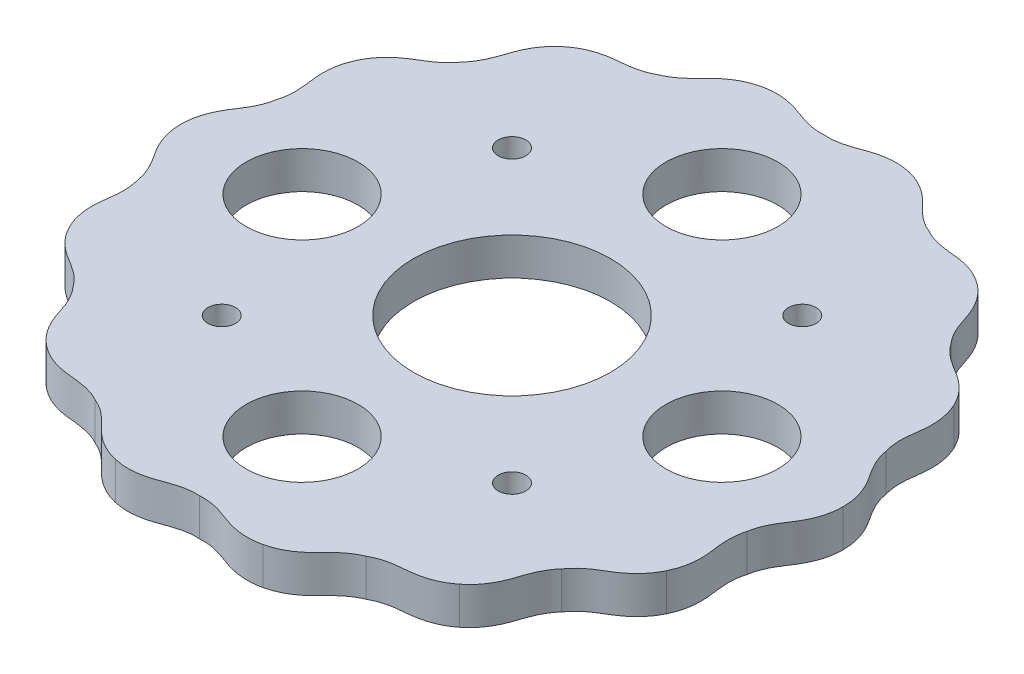
from build123d import *

# Parameters (mm, degrees)
BOSS_EXTRUDE3_DEPTH = 4
SKETCH2_R           = 10.5635
SKETCH2_R_2         = 6
CUT_EXTRUDE1_DEPTH  = 5
SKETCH2_4_R         = 1.48
CUT_EXTRUDE2_DEPTH  = 2.22


with BuildPart() as part:
    # Sketch1 → Boss-Extrude3 (new body)
    with BuildSketch(Plane(origin=(0, 0, 0), x_dir=(1, 0, 0), z_dir=(0, 1, 0))):
        with BuildLine():
            Line((35.500002326, 0.003735881), (35.500002326, 0))
            Line((35.500002326, 0), (35.500002326, -0.003735881))
            add(Edge.make_bspline(
                [(32.644810899, -7.45096506), (32.674793712, -7.260710929), (32.757965618, -6.873262555), (32.975088878, -6.197475635), (33.30681421, -5.487322542), (33.693887271, -4.83935734), (34.139372051, -4.165162167), (34.499748971, -3.6014921), (34.870711868, -2.889611748), (35.149566879, -2.192738575), (35.418263863, -1.23361479), (35.50061524, -0.495919336), (35.500002326, -0.003735881)],
                knots=[0.02301065, 0.02301065, 0.02301065, 0.02301065, 0.053541567, 0.084072485, 0.145134319, 0.206196153, 0.267257988, 0.389381656, 0.511505325, 0.633628994, 0.755752663, 1, 1, 1, 1], degree=3))
            add(Edge.make_bspline(
                [(31.986017844, -15.399507835), (32.200120458, -14.956331799), (32.445998494, -14.255960238), (32.62005909, -13.275236314), (32.671181344, -12.526384626), (32.645828632, -11.724047822), (32.565707523, -11.059836954), (32.456861927, -10.25911949), (32.389262714, -9.507378309), (32.398512397, -8.723622254), (32.496104055, -8.020553026), (32.589276306, -7.635387164), (32.644810899, -7.45096506)],
                knots=[0.02301065, 0.02301065, 0.02301065, 0.02301065, 0.267257988, 0.389381656, 0.511505325, 0.633628994, 0.755752663, 0.816814497, 0.877876331, 0.938938166, 0.969469083, 1, 1, 1, 1], degree=3))
            Line((31.986017844, -15.399507835), (31.984396906, -15.402873748))
            Line((31.984396906, -15.402873748), (31.982775968, -15.406239661))
            add(Edge.make_bspline(
                [(26.179105738, -20.877140171), (26.288667493, -20.718736177), (26.531710341, -20.405744191), (27.020544594, -19.891087467), (27.62754267, -19.395191866), (28.257425012, -18.979340099), (28.951315253, -18.565199839), (29.520570914, -18.213712342), (30.163670245, -17.733285076), (30.717271866, -17.226414698), (31.375507699, -16.478857279), (31.769777787, -15.849947564), (31.982775968, -15.406239661)],
                knots=[0.02301065, 0.02301065, 0.02301065, 0.02301065, 0.053541567, 0.084072485, 0.145134319, 0.206196153, 0.267257988, 0.389381656, 0.511505325, 0.633628994, 0.755752663, 1, 1, 1, 1], degree=3))
            add(Edge.make_bspline(
                [(22.136810246, -27.752690162), (22.521996911, -27.446297993), (23.047405198, -26.921967502), (23.62974854, -26.113887841), (24.00072267, -25.461376898), (24.326001557, -24.727496287), (24.542005228, -24.094299727), (24.791357022, -23.325651886), (25.05662051, -22.619026286), (25.405013194, -21.916899767), (25.797990545, -21.325799714), (26.049053047, -21.019203188), (26.179105738, -20.877140171)],
                knots=[0.02301065, 0.02301065, 0.02301065, 0.02301065, 0.267257988, 0.389381656, 0.511505325, 0.633628994, 0.755752663, 0.816814497, 0.877876331, 0.938938166, 0.969469083, 1, 1, 1, 1], degree=3))
            Line((22.136810246, -27.752690162), (22.133889416, -27.755019446))
            Line((22.133889416, -27.755019446), (22.130968587, -27.75734873))
            add(Edge.make_bspline(
                [(14.52830762, -30.168341629), (14.695748267, -30.073161626), (15.05052444, -29.89661793), (15.714250068, -29.645025478), (16.476297475, -29.461605575), (17.224233175, -29.360231784), (18.029095404, -29.288171996), (18.694481743, -29.218483478), (19.482343797, -29.064663811), (20.201044438, -28.848188121), (21.118447439, -28.460259983), (21.746546212, -28.06469929), (22.130968587, -27.75734873)],
                knots=[0.02301065, 0.02301065, 0.02301065, 0.02301065, 0.053541567, 0.084072485, 0.145134319, 0.206196153, 0.267257988, 0.389381656, 0.511505325, 0.633628994, 0.755752663, 1, 1, 1, 1], degree=3))
            add(Edge.make_bspline(
                [(7.903135888, -34.609111839), (8.383115662, -34.500188263), (9.083990645, -34.255748926), (9.959276491, -33.780363616), (10.576626521, -33.353431213), (11.188111536, -32.833360849), (11.657457809, -32.356590942), (12.215619812, -31.772252855), (12.761207314, -31.250698702), (13.379739556, -30.769266488), (13.990268616, -30.407210225), (14.349495361, -30.239908237), (14.52830762, -30.168341629)],
                knots=[0.02301065, 0.02301065, 0.02301065, 0.02301065, 0.267257988, 0.389381656, 0.511505325, 0.633628994, 0.755752663, 0.816814497, 0.877876331, 0.938938166, 0.969469083, 1, 1, 1, 1], degree=3))
            Line((7.903135888, -34.609111839), (7.899493673, -34.60994315))
            Line((7.899493673, -34.60994315), (7.895851458, -34.610774462))
            add(Edge.make_bspline(
                [(0, -33.484333037), (0.192155866, -33.471228592), (0.588397592, -33.466099831), (1.295555593, -33.527402621), (2.061719496, -33.692786976), (2.779570716, -33.925969485), (3.535992098, -34.210262493), (4.165721189, -34.43617562), (4.942300224, -34.639429423), (5.683752409, -34.756224087), (6.678619663, -34.804759157), (7.416144457, -34.72089313), (7.895851458, -34.610774462)],
                knots=[0.02301065, 0.02301065, 0.02301065, 0.02301065, 0.053541567, 0.084072485, 0.145134319, 0.206196153, 0.267257988, 0.389381656, 0.511505325, 0.633628994, 0.755752663, 1, 1, 1, 1], degree=3))
            add(Edge.make_bspline(
                [(-7.895851458, -34.610774462), (-7.416144457, -34.72089313), (-6.678619663, -34.804759157), (-5.683752409, -34.756224087), (-4.942300224, -34.639429423), (-4.165721189, -34.43617562), (-3.535992098, -34.210262493), (-2.779570716, -33.925969485), (-2.061719496, -33.692786976), (-1.295555593, -33.527402621), (-0.588397592, -33.466099831), (-0.192155866, -33.471228592), (0, -33.484333037)],
                knots=[0.02301065, 0.02301065, 0.02301065, 0.02301065, 0.267257988, 0.389381656, 0.511505325, 0.633628994, 0.755752663, 0.816814497, 0.877876331, 0.938938166, 0.969469083, 1, 1, 1, 1], degree=3))
            Line((-7.895851458, -34.610774462), (-7.899493673, -34.60994315))
            Line((-7.899493673, -34.60994315), (-7.903135888, -34.609111839))
            add(Edge.make_bspline(
                [(-14.52830762, -30.168341629), (-14.349495361, -30.239908237), (-13.990268616, -30.407210225), (-13.379739556, -30.769266488), (-12.761207314, -31.250698702), (-12.215619812, -31.772252855), (-11.657457809, -32.356590942), (-11.188111536, -32.833360849), (-10.576626521, -33.353431213), (-9.959276491, -33.780363616), (-9.083990645, -34.255748926), (-8.383115662, -34.500188263), (-7.903135888, -34.609111839)],
                knots=[0.02301065, 0.02301065, 0.02301065, 0.02301065, 0.053541567, 0.084072485, 0.145134319, 0.206196153, 0.267257988, 0.389381656, 0.511505325, 0.633628994, 0.755752663, 1, 1, 1, 1], degree=3))
            add(Edge.make_bspline(
                [(-22.130968587, -27.75734873), (-21.746546212, -28.06469929), (-21.118447439, -28.460259983), (-20.201044438, -28.848188121), (-19.482343797, -29.064663811), (-18.694481743, -29.218483478), (-18.029095404, -29.288171996), (-17.224233175, -29.360231784), (-16.476297475, -29.461605575), (-15.714250068, -29.645025478), (-15.05052444, -29.89661793), (-14.695748267, -30.073161626), (-14.52830762, -30.168341629)],
                knots=[0.02301065, 0.02301065, 0.02301065, 0.02301065, 0.267257988, 0.389381656, 0.511505325, 0.633628994, 0.755752663, 0.816814497, 0.877876331, 0.938938166, 0.969469083, 1, 1, 1, 1], degree=3))
            Line((-22.130968587, -27.75734873), (-22.133889416, -27.755019446))
            Line((-22.133889416, -27.755019446), (-22.136810246, -27.752690162))
            add(Edge.make_bspline(
                [(-26.179105738, -20.877140171), (-26.049053047, -21.019203188), (-25.797990545, -21.325799714), (-25.405013194, -21.916899767), (-25.05662051, -22.619026286), (-24.791357022, -23.325651886), (-24.542005228, -24.094299727), (-24.326001557, -24.727496287), (-24.00072267, -25.461376898), (-23.62974854, -26.113887841), (-23.047405198, -26.921967502), (-22.521996911, -27.446297993), (-22.136810246, -27.752690162)],
                knots=[0.02301065, 0.02301065, 0.02301065, 0.02301065, 0.053541567, 0.084072485, 0.145134319, 0.206196153, 0.267257988, 0.389381656, 0.511505325, 0.633628994, 0.755752663, 1, 1, 1, 1], degree=3))
            add(Edge.make_bspline(
                [(-31.982775968, -15.406239661), (-31.769777787, -15.849947564), (-31.375507698, -16.478857279), (-30.717271866, -17.226414698), (-30.163670245, -17.733285076), (-29.520570914, -18.213712342), (-28.951315253, -18.565199839), (-28.257425012, -18.979340099), (-27.62754267, -19.395191866), (-27.020544594, -19.891087467), (-26.531710341, -20.405744191), (-26.288667493, -20.718736177), (-26.179105738, -20.877140171)],
                knots=[0.02301065, 0.02301065, 0.02301065, 0.02301065, 0.267257988, 0.389381656, 0.511505325, 0.633628994, 0.755752663, 0.816814497, 0.877876331, 0.938938166, 0.969469083, 1, 1, 1, 1], degree=3))
            Line((-31.982775968, -15.406239661), (-31.984396906, -15.402873748))
            Line((-31.984396906, -15.402873748), (-31.986017844, -15.399507835))
            add(Edge.make_bspline(
                [(-32.644810899, -7.45096506), (-32.589276306, -7.635387164), (-32.496104055, -8.020553026), (-32.398512397, -8.723622254), (-32.389262714, -9.507378309), (-32.456861927, -10.25911949), (-32.565707523, -11.059836954), (-32.645828632, -11.724047822), (-32.671181344, -12.526384626), (-32.62005909, -13.275236314), (-32.445998494, -14.255960238), (-32.200120458, -14.956331799), (-31.986017844, -15.399507835)],
                knots=[0.02301065, 0.02301065, 0.02301065, 0.02301065, 0.053541567, 0.084072485, 0.145134319, 0.206196153, 0.267257988, 0.389381656, 0.511505325, 0.633628994, 0.755752663, 1, 1, 1, 1], degree=3))
            add(Edge.make_bspline(
                [(-35.500002326, -0.003735881), (-35.50061524, -0.495919336), (-35.418263863, -1.23361479), (-35.149566879, -2.192738575), (-34.870711868, -2.889611748), (-34.499748971, -3.6014921), (-34.139372051, -4.165162167), (-33.693887271, -4.83935734), (-33.30681421, -5.487322542), (-32.975088878, -6.197475635), (-32.757965618, -6.873262555), (-32.674793712, -7.260710929), (-32.644810899, -7.45096506)],
                knots=[0.02301065, 0.02301065, 0.02301065, 0.02301065, 0.267257988, 0.389381656, 0.511505325, 0.633628994, 0.755752663, 0.816814497, 0.877876331, 0.938938166, 0.969469083, 1, 1, 1, 1], degree=3))
            Line((-35.500002326, -0.003735881), (-35.500002326, 0))
            Line((-35.500002326, 0), (-35.500002326, 0.003735881))
            add(Edge.make_bspline(
                [(-32.644810899, 7.45096506), (-32.674793712, 7.260710929), (-32.757965618, 6.873262555), (-32.975088878, 6.197475635), (-33.30681421, 5.487322542), (-33.693887271, 4.83935734), (-34.139372051, 4.165162167), (-34.499748971, 3.6014921), (-34.870711868, 2.889611748), (-35.149566879, 2.192738575), (-35.418263863, 1.23361479), (-35.50061524, 0.495919336), (-35.500002326, 0.003735881)],
                knots=[0.02301065, 0.02301065, 0.02301065, 0.02301065, 0.053541567, 0.084072485, 0.145134319, 0.206196153, 0.267257988, 0.389381656, 0.511505325, 0.633628994, 0.755752663, 1, 1, 1, 1], degree=3))
            add(Edge.make_bspline(
                [(-31.986017844, 15.399507835), (-32.200120458, 14.956331799), (-32.445998494, 14.255960238), (-32.62005909, 13.275236314), (-32.671181344, 12.526384626), (-32.645828632, 11.724047822), (-32.565707523, 11.059836954), (-32.456861927, 10.25911949), (-32.389262714, 9.507378309), (-32.398512397, 8.723622254), (-32.496104055, 8.020553026), (-32.589276306, 7.635387164), (-32.644810899, 7.45096506)],
                knots=[0.02301065, 0.02301065, 0.02301065, 0.02301065, 0.267257988, 0.389381656, 0.511505325, 0.633628994, 0.755752663, 0.816814497, 0.877876331, 0.938938166, 0.969469083, 1, 1, 1, 1], degree=3))
            Line((-31.986017844, 15.399507835), (-31.984396906, 15.402873748))
            Line((-31.984396906, 15.402873748), (-31.982775968, 15.406239661))
            add(Edge.make_bspline(
                [(-26.179105738, 20.877140171), (-26.288667493, 20.718736177), (-26.531710341, 20.405744191), (-27.020544594, 19.891087467), (-27.62754267, 19.395191866), (-28.257425012, 18.979340099), (-28.951315253, 18.565199839), (-29.520570914, 18.213712342), (-30.163670245, 17.733285076), (-30.717271866, 17.226414698), (-31.375507699, 16.478857278), (-31.769777787, 15.849947564), (-31.982775968, 15.406239661)],
                knots=[0.02301065, 0.02301065, 0.02301065, 0.02301065, 0.053541567, 0.084072485, 0.145134319, 0.206196153, 0.267257988, 0.389381656, 0.511505325, 0.633628994, 0.755752663, 1, 1, 1, 1], degree=3))
            add(Edge.make_bspline(
                [(-22.136810246, 27.752690162), (-22.521996911, 27.446297993), (-23.047405198, 26.921967502), (-23.62974854, 26.113887841), (-24.00072267, 25.461376898), (-24.326001557, 24.727496287), (-24.542005228, 24.094299727), (-24.791357022, 23.325651886), (-25.05662051, 22.619026286), (-25.405013194, 21.916899767), (-25.797990545, 21.325799714), (-26.049053047, 21.019203188), (-26.179105738, 20.877140171)],
                knots=[0.02301065, 0.02301065, 0.02301065, 0.02301065, 0.267257988, 0.389381656, 0.511505325, 0.633628994, 0.755752663, 0.816814497, 0.877876331, 0.938938166, 0.969469083, 1, 1, 1, 1], degree=3))
            Line((-22.136810246, 27.752690162), (-22.133889416, 27.755019446))
            Line((-22.133889416, 27.755019446), (-22.130968587, 27.75734873))
            add(Edge.make_bspline(
                [(-14.52830762, 30.168341629), (-14.695748267, 30.073161626), (-15.05052444, 29.89661793), (-15.714250068, 29.645025478), (-16.476297475, 29.461605575), (-17.224233175, 29.360231784), (-18.029095404, 29.288171996), (-18.694481743, 29.218483478), (-19.482343797, 29.064663811), (-20.201044438, 28.848188121), (-21.118447439, 28.460259983), (-21.746546212, 28.06469929), (-22.130968587, 27.75734873)],
                knots=[0.02301065, 0.02301065, 0.02301065, 0.02301065, 0.053541567, 0.084072485, 0.145134319, 0.206196153, 0.267257988, 0.389381656, 0.511505325, 0.633628994, 0.755752663, 1, 1, 1, 1], degree=3))
            add(Edge.make_bspline(
                [(-7.903135888, 34.609111839), (-8.383115662, 34.500188263), (-9.083990645, 34.255748926), (-9.959276491, 33.780363616), (-10.576626521, 33.353431213), (-11.188111536, 32.833360849), (-11.657457809, 32.356590942), (-12.215619812, 31.772252855), (-12.761207314, 31.250698702), (-13.379739556, 30.769266488), (-13.990268616, 30.407210225), (-14.349495361, 30.239908237), (-14.52830762, 30.168341629)],
                knots=[0.02301065, 0.02301065, 0.02301065, 0.02301065, 0.267257988, 0.389381656, 0.511505325, 0.633628994, 0.755752663, 0.816814497, 0.877876331, 0.938938166, 0.969469083, 1, 1, 1, 1], degree=3))
            Line((-7.903135888, 34.609111839), (-7.899493673, 34.60994315))
            Line((-7.899493673, 34.60994315), (-7.895851458, 34.610774462))
            add(Edge.make_bspline(
                [(0, 33.484333037), (-0.192155866, 33.471228592), (-0.588397592, 33.466099831), (-1.295555593, 33.527402621), (-2.061719496, 33.692786976), (-2.779570716, 33.925969485), (-3.535992098, 34.210262493), (-4.165721189, 34.43617562), (-4.942300224, 34.639429423), (-5.683752409, 34.756224087), (-6.678619663, 34.804759157), (-7.416144457, 34.72089313), (-7.895851458, 34.610774462)],
                knots=[0.02301065, 0.02301065, 0.02301065, 0.02301065, 0.053541567, 0.084072485, 0.145134319, 0.206196153, 0.267257988, 0.389381656, 0.511505325, 0.633628994, 0.755752663, 1, 1, 1, 1], degree=3))
            add(Edge.make_bspline(
                [(7.895851458, 34.610774462), (7.416144457, 34.72089313), (6.678619663, 34.804759157), (5.683752409, 34.756224087), (4.942300224, 34.639429423), (4.165721189, 34.43617562), (3.535992098, 34.210262493), (2.779570716, 33.925969485), (2.061719496, 33.692786976), (1.295555593, 33.527402621), (0.588397592, 33.466099831), (0.192155866, 33.471228592), (0, 33.484333037)],
                knots=[0.02301065, 0.02301065, 0.02301065, 0.02301065, 0.267257988, 0.389381656, 0.511505325, 0.633628994, 0.755752663, 0.816814497, 0.877876331, 0.938938166, 0.969469083, 1, 1, 1, 1], degree=3))
            Line((7.895851458, 34.610774462), (7.899493673, 34.60994315))
            Line((7.899493673, 34.60994315), (7.903135888, 34.609111839))
            add(Edge.make_bspline(
                [(14.52830762, 30.168341629), (14.349495361, 30.239908237), (13.990268616, 30.407210225), (13.379739556, 30.769266488), (12.761207314, 31.250698702), (12.215619812, 31.772252855), (11.657457809, 32.356590942), (11.188111536, 32.833360849), (10.576626521, 33.353431213), (9.959276491, 33.780363616), (9.083990645, 34.255748926), (8.383115662, 34.500188263), (7.903135888, 34.609111839)],
                knots=[0.02301065, 0.02301065, 0.02301065, 0.02301065, 0.053541567, 0.084072485, 0.145134319, 0.206196153, 0.267257988, 0.389381656, 0.511505325, 0.633628994, 0.755752663, 1, 1, 1, 1], degree=3))
            add(Edge.make_bspline(
                [(22.130968587, 27.75734873), (21.746546212, 28.06469929), (21.118447439, 28.460259983), (20.201044438, 28.848188121), (19.482343797, 29.064663811), (18.694481743, 29.218483478), (18.029095404, 29.288171996), (17.224233175, 29.360231784), (16.476297475, 29.461605575), (15.714250068, 29.645025478), (15.05052444, 29.89661793), (14.695748267, 30.073161626), (14.52830762, 30.168341629)],
                knots=[0.02301065, 0.02301065, 0.02301065, 0.02301065, 0.267257988, 0.389381656, 0.511505325, 0.633628994, 0.755752663, 0.816814497, 0.877876331, 0.938938166, 0.969469083, 1, 1, 1, 1], degree=3))
            Line((22.130968587, 27.75734873), (22.133889416, 27.755019446))
            Line((22.133889416, 27.755019446), (22.136810246, 27.752690162))
            add(Edge.make_bspline(
                [(26.179105738, 20.877140171), (26.049053047, 21.019203188), (25.797990545, 21.325799714), (25.405013194, 21.916899767), (25.05662051, 22.619026286), (24.791357022, 23.325651886), (24.542005228, 24.094299727), (24.326001557, 24.727496287), (24.00072267, 25.461376898), (23.62974854, 26.113887841), (23.047405198, 26.921967502), (22.521996911, 27.446297993), (22.136810246, 27.752690162)],
                knots=[0.02301065, 0.02301065, 0.02301065, 0.02301065, 0.053541567, 0.084072485, 0.145134319, 0.206196153, 0.267257988, 0.389381656, 0.511505325, 0.633628994, 0.755752663, 1, 1, 1, 1], degree=3))
            add(Edge.make_bspline(
                [(31.982775968, 15.406239661), (31.769777787, 15.849947564), (31.375507698, 16.478857279), (30.717271866, 17.226414698), (30.163670245, 17.733285076), (29.520570914, 18.213712342), (28.951315253, 18.565199839), (28.257425012, 18.979340099), (27.62754267, 19.395191866), (27.020544594, 19.891087467), (26.531710341, 20.405744191), (26.288667493, 20.718736177), (26.179105738, 20.877140171)],
                knots=[0.02301065, 0.02301065, 0.02301065, 0.02301065, 0.267257988, 0.389381656, 0.511505325, 0.633628994, 0.755752663, 0.816814497, 0.877876331, 0.938938166, 0.969469083, 1, 1, 1, 1], degree=3))
            Line((31.982775968, 15.406239661), (31.984396906, 15.402873748))
            Line((31.984396906, 15.402873748), (31.986017844, 15.399507835))
            add(Edge.make_bspline(
                [(32.644810899, 7.45096506), (32.589276306, 7.635387164), (32.496104055, 8.020553026), (32.398512397, 8.723622254), (32.389262714, 9.507378309), (32.456861927, 10.25911949), (32.565707523, 11.059836954), (32.645828632, 11.724047822), (32.671181344, 12.526384626), (32.62005909, 13.275236314), (32.445998494, 14.255960238), (32.200120458, 14.956331799), (31.986017844, 15.399507835)],
                knots=[0.02301065, 0.02301065, 0.02301065, 0.02301065, 0.053541567, 0.084072485, 0.145134319, 0.206196153, 0.267257988, 0.389381656, 0.511505325, 0.633628994, 0.755752663, 1, 1, 1, 1], degree=3))
            add(Edge.make_bspline(
                [(35.500002326, 0.003735881), (35.50061524, 0.495919336), (35.418263863, 1.23361479), (35.149566879, 2.192738575), (34.870711868, 2.889611748), (34.499748971, 3.6014921), (34.139372051, 4.165162167), (33.693887271, 4.83935734), (33.30681421, 5.487322542), (32.975088878, 6.197475635), (32.757965618, 6.873262555), (32.674793712, 7.260710929), (32.644810899, 7.45096506)],
                knots=[0.02301065, 0.02301065, 0.02301065, 0.02301065, 0.267257988, 0.389381656, 0.511505325, 0.633628994, 0.755752663, 0.816814497, 0.877876331, 0.938938166, 0.969469083, 1, 1, 1, 1], degree=3))
        make_face()
    extrude(amount=BOSS_EXTRUDE3_DEPTH)

    # Sketch2 → Cut-Extrude1 (cut)
    with BuildSketch(Plane(origin=(0, 4, 0), x_dir=(1, 0, 0), z_dir=(0, 1, 0))):
        Circle(SKETCH2_R)
        with Locations((22.5, 0)):
            Circle(SKETCH2_R_2)
        with Locations((0, -22.5)):
            Circle(SKETCH2_R_2)
        with Locations((-22.5, 0)):
            Circle(SKETCH2_R_2)
        with Locations((0, 22.5)):
            Circle(SKETCH2_R_2)
    extrude(amount=-CUT_EXTRUDE1_DEPTH, mode=Mode.SUBTRACT)

    # Sketch2<4> → Cut-Extrude2 (cut)
    with BuildSketch(Plane(origin=(0, 4, 0), x_dir=(1, 0, 0), z_dir=(0, 1, 0))):
        with Locations((15.556349186, 15.556349186)):
            Circle(SKETCH2_4_R)
        with Locations((15.556349186, -15.556349186)):
            Circle(SKETCH2_4_R)
        with Locations((-15.556349186, -15.556349186)):
            Circle(SKETCH2_4_R)
        with Locations((-15.556349186, 15.556349186)):
            Circle(SKETCH2_4_R)
    extrude(amount=-CUT_EXTRUDE2_DEPTH, mode=Mode.SUBTRACT)


solid = part.part
